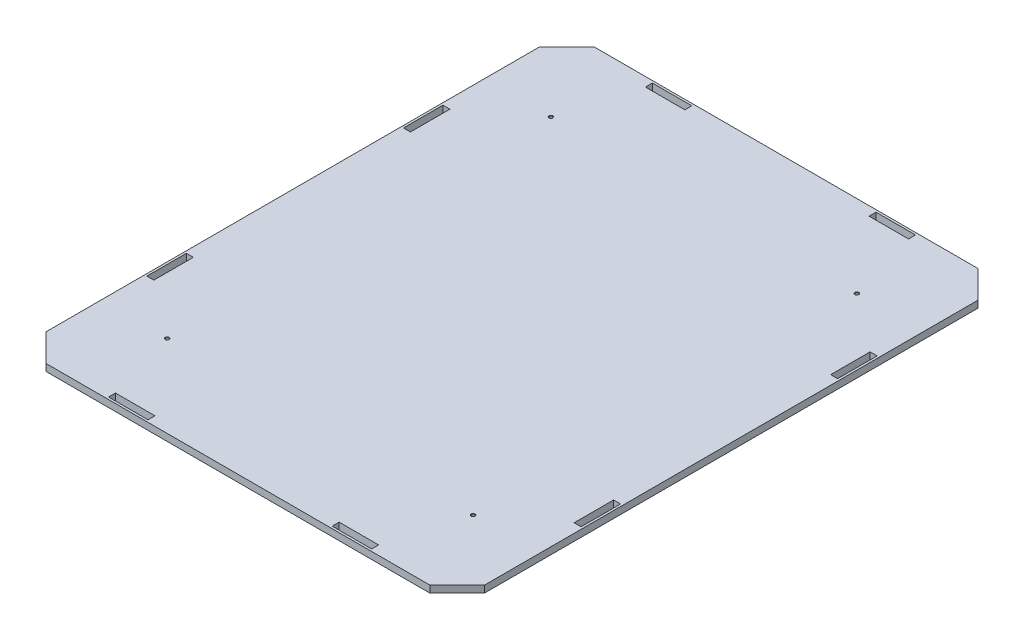
from build123d import *

# Parameters (mm, degrees)
SKETCH2_W                         = 400
SKETCH2_H                         = 500
BOSS_EXTRUDE2_DEPTH               = 6.35
M3_5X0_6_TAPPED_HOLE2_D           = 2.9
M3_5X0_6_TAPPED_HOLE2_CSINK_D     = 3.55
M3_5X0_6_TAPPED_HOLE2_CSINK_ANGLE = 90
CHAMFER1_SIZE                     = 25
SKETCH9_W                         = 6.35
SKETCH9_H                         = 36
SKETCH9_W_2                       = 36
SKETCH9_H_2                       = 6.35
CUT_EXTRUDE1_DEPTH                = 321.219178845


with BuildPart() as part:
    # Sketch2 → Boss-Extrude2 (new body)
    with BuildSketch(Plane(origin=(0, 0, 0), x_dir=(1, 0, 0), z_dir=(0, 1, 0))):
        Rectangle(SKETCH2_W, SKETCH2_H)
    extrude(amount=BOSS_EXTRUDE2_DEPTH)

    # M3.5x0.6 Tapped Hole2 (through all)
    with Locations(Plane(origin=(0, 6.35, 0), x_dir=(1, 0, 0), z_dir=(0, 1, 0))):
        with Locations((-139.5, 175), (139.5, 175), (-139.5, -175), (139.5, -175)):
            CounterSinkHole(M3_5X0_6_TAPPED_HOLE2_D / 2, M3_5X0_6_TAPPED_HOLE2_CSINK_D / 2, counter_sink_angle=M3_5X0_6_TAPPED_HOLE2_CSINK_ANGLE)

    # Chamfer1
    chamfer1_edges = [part.edges().sort_by_distance(p)[0] for p in [
        (200, 3.175, 250),
        (-200, 3.175, 250),
        (-200, 3.175, -250),
        (200, 3.175, -250),
    ]]
    chamfer(chamfer1_edges, length=CHAMFER1_SIZE)

    # Sketch9 → Cut-Extrude1 (cut, through all)
    with BuildSketch(Plane(origin=(0, 6.35, 0), x_dir=(1, 0, 0), z_dir=(0, 1, 0))):
        with Locations((194.825, 117)):
            Rectangle(SKETCH9_W, SKETCH9_H)
        with Locations((102, -244.825)):
            Rectangle(SKETCH9_W_2, SKETCH9_H_2)
        with Locations((-102, -244.825)):
            Rectangle(SKETCH9_W_2, SKETCH9_H_2)
        with Locations((-102, 244.825)):
            Rectangle(SKETCH9_W_2, SKETCH9_H_2)
        with Locations((102, 244.825)):
            Rectangle(SKETCH9_W_2, SKETCH9_H_2)
        with Locations((194.825, -117)):
            Rectangle(SKETCH9_W, SKETCH9_H)
        with Locations((-194.825, -117)):
            Rectangle(SKETCH9_W, SKETCH9_H)
        with Locations((-194.825, 117)):
            Rectangle(SKETCH9_W, SKETCH9_H)
    extrude(amount=-CUT_EXTRUDE1_DEPTH, mode=Mode.SUBTRACT)


solid = part.part
